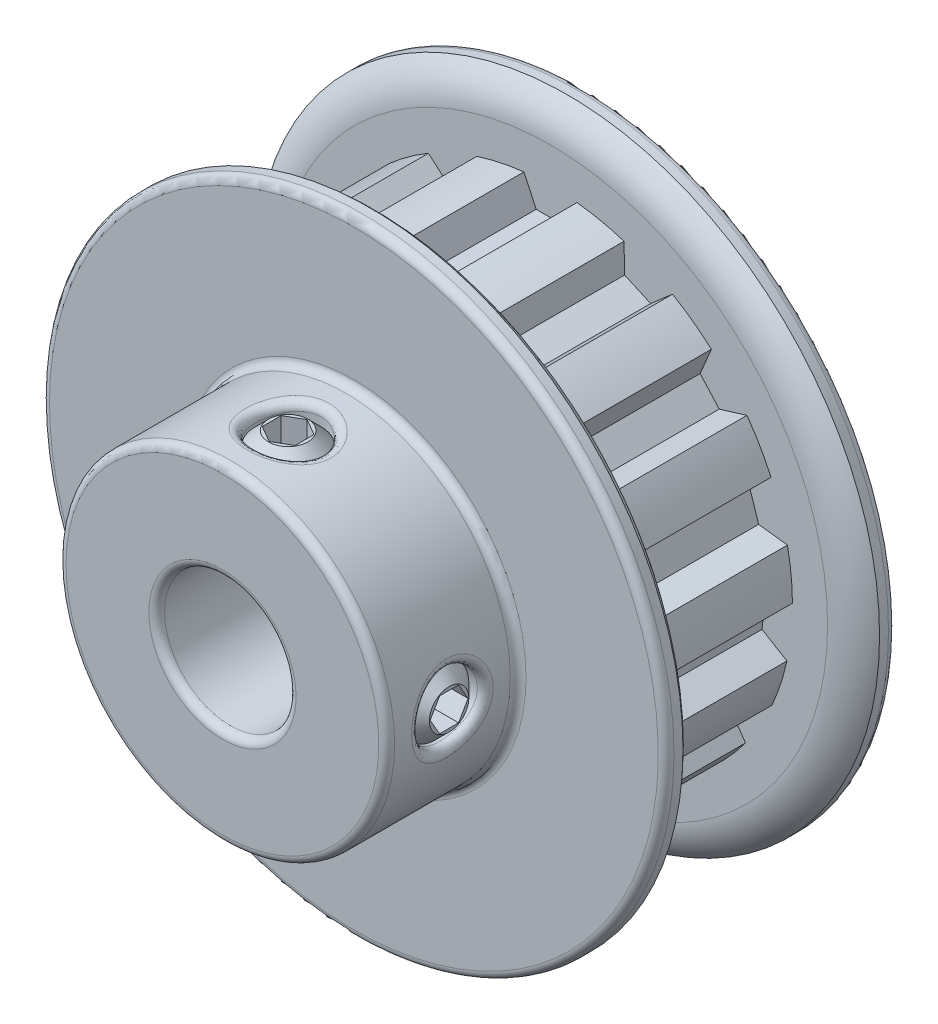
from build123d import *

# Parameters (mm, degrees)
CUT_EXTRUDE1_START = 0.762
CUT_EXTRUDE1_DEPTH = 7.874
CIRPATTERN1_COUNT  = 15
SKETCH4_R          = 1.5875
CUT_EXTRUDE2_DEPTH = 24.056821144
CUT_EXTRUDE3_DEPTH = 1.190625
CIRPATTERN2_COUNT  = 2
CIRPATTERN2_ANGLE  = 90
FILLET1_R          = 0.381


with BuildPart() as part:
    # Sketch2 → Revolve1 (revolve)
    with BuildSketch(Plane(origin=(0, 0, 0), x_dir=(0, 0, -1), z_dir=(1, 0, 0)), mode=Mode.PRIVATE) as revolve1_sk:
        with BuildLine():
            Line((-8.7376, 3.175), (8.7376, 3.175))
            Line((8.7376, 3.175), (8.7376, 15.0876))
            Line((8.7376, 15.0876), (7.9248, 15.0876))
            ThreePointArc((7.9248, 15.0876), (7.325668416, 14.330712642), (7.112, 13.389339743))
            Line((7.112, 13.389339743), (7.112, 11.691079486))
            Line((7.112, 11.691079486), (-0.762, 11.691079486))
            Line((-0.762, 11.691079486), (-0.762, 13.389339743))
            ThreePointArc((-0.762, 13.389339743), (-0.975668416, 14.330712642), (-1.5748, 15.0876))
            Line((-1.5748, 15.0876), (-2.3876, 15.0876))
            Line((-2.3876, 15.0876), (-2.3876, 7.9375))
            Line((-2.3876, 7.9375), (-8.7376, 7.9375))
            Line((-8.7376, 7.9375), (-8.7376, 3.175))
        make_face()
    revolve(revolve1_sk.sketch.rotate(Axis((0, 0, 8.7376), (0, 0, -1)), 90), axis=Axis((0, 0, 8.7376), (0, 0, -1)))

    # Sketch3 → Cut-Extrude1 (cut)
    with BuildSketch(Plane.XY.offset(CUT_EXTRUDE1_START)):
        with BuildLine():
            Line((-0.690489274, 10.3505), (0.690489274, 10.3505))
            Line((0.690489274, 10.3505), (1.2827, 11.6205))
            ThreePointArc((1.2827, 11.6205), (0, 11.691079486), (-1.2827, 11.6205))
            Line((-1.2827, 11.6205), (-0.690489274, 10.3505))
        make_face()
    cut_extrude1 = extrude(amount=-CUT_EXTRUDE1_DEPTH, mode=Mode.SUBTRACT)

    # CirPattern1: Cut-Extrude1 ×15 about axis
    cirpattern1_axis = Axis((0, 0, 0), (0, 0, 1))
    for i in range(1, CIRPATTERN1_COUNT):
        add(cut_extrude1.rotate(cirpattern1_axis, i * 360 / CIRPATTERN1_COUNT), mode=Mode.SUBTRACT)

    # Sketch4 → Cut-Extrude2 (cut, through all)
    with BuildSketch(Plane(origin=(0, 0, 0), x_dir=(1, 0, 0), z_dir=(0, 1, 0))):
        with Locations(Location((0, -5.5626, 0), (0, 0, 90))):
            Circle(SKETCH4_R)
    cut_extrude2 = extrude(amount=CUT_EXTRUDE2_DEPTH, mode=Mode.SUBTRACT)

    # Sketch5 → Revolve2 (revolve)
    with BuildSketch(Plane.XY.offset(5.5626), mode=Mode.PRIVATE) as revolve2_sk:
        Polygon((0, 7.777129933), (0, 3.175), (-0.9525, 3.175), (-1.5875, 3.81), (-1.5875, 7.142129933), (-0.9525, 7.777129933), align=None)
    revolve2 = revolve(revolve2_sk.sketch.rotate(Axis((0, 0, 5.5626), (0, 1, 0)), 270), axis=Axis((0, 0, 5.5626), (0, 1, 0)))

    # Sketch6 → Cut-Extrude3 (cut)
    with BuildSketch(Plane(origin=(0, 7.777129933, 0), x_dir=(-1, 0, 0), z_dir=(0, -1, 0))):
        Polygon((0, -4.646056448), (-0.79375, -5.104328224), (-0.79375, -6.020871776), (0, -6.479143552), (0.79375, -6.020871776), (0.79375, -5.104328224), align=None)
    cut_extrude3 = extrude(amount=CUT_EXTRUDE3_DEPTH, mode=Mode.SUBTRACT)

    # CirPattern2: Cut-Extrude2, Revolve2, Cut-Extrude3 ×2 about axis
    cirpattern2_axis = Axis((0, 0, 0), (0, 0, -1))
    add([cut_extrude2.rotate(cirpattern2_axis, i * CIRPATTERN2_ANGLE / (CIRPATTERN2_COUNT - 1)) for i in range(1, CIRPATTERN2_COUNT)], mode=Mode.SUBTRACT)
    add([revolve2.rotate(cirpattern2_axis, i * CIRPATTERN2_ANGLE / (CIRPATTERN2_COUNT - 1)) for i in range(1, CIRPATTERN2_COUNT)])
    add([cut_extrude3.rotate(cirpattern2_axis, i * CIRPATTERN2_ANGLE / (CIRPATTERN2_COUNT - 1)) for i in range(1, CIRPATTERN2_COUNT)], mode=Mode.SUBTRACT)

    # Fillet1
    fillet1_edges = [part.edges().sort_by_distance(p)[0] for p in [
        (-15.0876, 0, -8.7376),
        (-3.175, 0, -8.7376),
        (-3.175, 0, 8.7376),
        (-4e-09, 7.937499998, 7.150100007),
        (7.777129933, -1.5875, 5.5626),
        (-7.9375, 0, 8.7376),
        (-7.9375, 0, 2.3876),
        (-15.0876, 0, 2.3876),
    ]]
    fillet(fillet1_edges, radius=FILLET1_R)


solid = part.part
